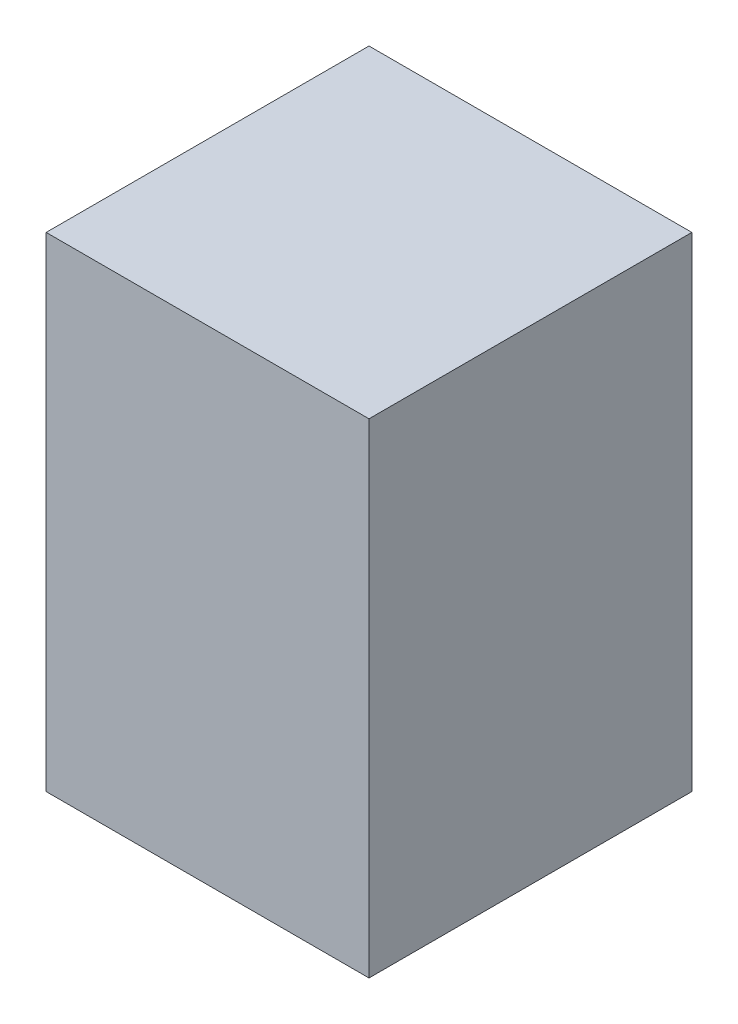
from build123d import *

# Parameters (mm, degrees)
SKETCH1_W           = 152.4
SKETCH1_H           = 152.4
BOSS_EXTRUDE1_DEPTH = 228.6


with BuildPart() as part:
    # Sketch1 → Boss-Extrude1 (new body)
    with BuildSketch(Plane(origin=(0, 0, 0), x_dir=(1, 0, 0), z_dir=(0, 1, 0))):
        Rectangle(SKETCH1_W, SKETCH1_H)
    extrude(amount=BOSS_EXTRUDE1_DEPTH)


solid = part.part
